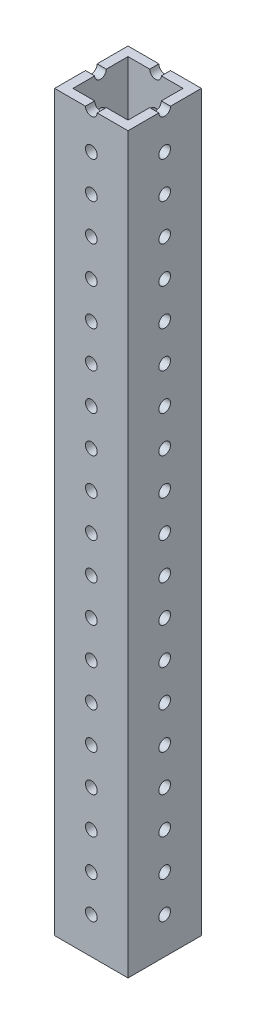
from build123d import *

# Parameters (mm, degrees)
SKETCH1_W           = 25.4
SKETCH1_H           = 25.4
SKETCH1_W_2         = 19.05
SKETCH1_H_2         = 19.05
BOSS_EXTRUDE1_DEPTH = 254
SKETCH2_R           = 2.0193
CUT_EXTRUDE1_DEPTH  = 635
SKETCH3_R           = 2.0193
CUT_EXTRUDE2_DEPTH  = 635


with BuildPart() as part:
    # Sketch1 → Boss-Extrude1 (new body)
    with BuildSketch(Plane(origin=(0, 0, 0), x_dir=(1, 0, 0), z_dir=(0, 1, 0))):
        with Locations((12.7, 12.7)):
            Rectangle(SKETCH1_W, SKETCH1_H)
        with Locations((12.7, 12.7)):
            Rectangle(SKETCH1_W_2, SKETCH1_H_2, mode=Mode.SUBTRACT)
    extrude(amount=BOSS_EXTRUDE1_DEPTH)

    # Sketch2 → Cut-Extrude1 (cut)
    with BuildSketch(Plane.XY):
        with Locations((12.7, 12.7)):
            Circle(SKETCH2_R)
        with Locations((12.7, 25.4)):
            Circle(SKETCH2_R)
        with Locations((12.7, 38.1)):
            Circle(SKETCH2_R)
        with Locations((12.7, 50.8)):
            Circle(SKETCH2_R)
        with Locations((12.7, 63.5)):
            Circle(SKETCH2_R)
        with Locations((12.7, 76.2)):
            Circle(SKETCH2_R)
        with Locations((12.7, 88.9)):
            Circle(SKETCH2_R)
        with Locations((12.7, 101.6)):
            Circle(SKETCH2_R)
        with Locations((12.7, 114.3)):
            Circle(SKETCH2_R)
        with Locations((12.7, 127)):
            Circle(SKETCH2_R)
        with Locations((12.7, 139.7)):
            Circle(SKETCH2_R)
        with Locations((12.7, 152.4)):
            Circle(SKETCH2_R)
        with Locations((12.7, 165.1)):
            Circle(SKETCH2_R)
        with Locations((12.7, 177.8)):
            Circle(SKETCH2_R)
        with Locations((12.7, 190.5)):
            Circle(SKETCH2_R)
        with Locations((12.7, 203.2)):
            Circle(SKETCH2_R)
        with Locations((12.7, 215.9)):
            Circle(SKETCH2_R)
        with Locations((12.7, 228.6)):
            Circle(SKETCH2_R)
        with Locations((12.7, 241.3)):
            Circle(SKETCH2_R)
        with Locations((12.7, 254)):
            Circle(SKETCH2_R)
        with Locations((12.7, 266.7)):
            Circle(SKETCH2_R)
        with Locations((12.7, 279.4)):
            Circle(SKETCH2_R)
        with Locations((12.7, 292.1)):
            Circle(SKETCH2_R)
        with Locations((12.7, 304.8)):
            Circle(SKETCH2_R)
        with Locations((12.7, 317.5)):
            Circle(SKETCH2_R)
        with Locations((12.7, 330.2)):
            Circle(SKETCH2_R)
        with Locations((12.7, 342.9)):
            Circle(SKETCH2_R)
        with Locations((12.7, 355.6)):
            Circle(SKETCH2_R)
        with Locations((12.7, 368.3)):
            Circle(SKETCH2_R)
        with Locations((12.7, 381)):
            Circle(SKETCH2_R)
        with Locations((12.7, 393.7)):
            Circle(SKETCH2_R)
        with Locations((12.7, 406.4)):
            Circle(SKETCH2_R)
        with Locations((12.7, 419.1)):
            Circle(SKETCH2_R)
        with Locations((12.7, 431.8)):
            Circle(SKETCH2_R)
        with Locations((12.7, 444.5)):
            Circle(SKETCH2_R)
        with Locations((12.7, 457.2)):
            Circle(SKETCH2_R)
        with Locations((12.7, 469.9)):
            Circle(SKETCH2_R)
        with Locations((12.7, 482.6)):
            Circle(SKETCH2_R)
        with Locations((12.7, 495.3)):
            Circle(SKETCH2_R)
        with Locations((12.7, 508)):
            Circle(SKETCH2_R)
        with Locations((12.7, 520.7)):
            Circle(SKETCH2_R)
        with Locations((12.7, 533.4)):
            Circle(SKETCH2_R)
        with Locations((12.7, 546.1)):
            Circle(SKETCH2_R)
        with Locations((12.7, 558.8)):
            Circle(SKETCH2_R)
        with Locations((12.7, 571.5)):
            Circle(SKETCH2_R)
        with Locations((12.7, 584.2)):
            Circle(SKETCH2_R)
        with Locations((12.7, 596.9)):
            Circle(SKETCH2_R)
        with Locations((12.7, 609.6)):
            Circle(SKETCH2_R)
        with Locations((12.7, 622.3)):
            Circle(SKETCH2_R)
    extrude(amount=-CUT_EXTRUDE1_DEPTH, mode=Mode.SUBTRACT)

    # Sketch3 → Cut-Extrude2 (cut)
    with BuildSketch(Plane(origin=(25.4, 0, 0), x_dir=(0, 0, -1), z_dir=(1, 0, 0))):
        with Locations((12.7, 12.7)):
            Circle(SKETCH3_R)
        with Locations((12.7, 25.4)):
            Circle(SKETCH3_R)
        with Locations((12.7, 38.1)):
            Circle(SKETCH3_R)
        with Locations((12.7, 50.8)):
            Circle(SKETCH3_R)
        with Locations((12.7, 63.5)):
            Circle(SKETCH3_R)
        with Locations((12.7, 76.2)):
            Circle(SKETCH3_R)
        with Locations((12.7, 88.9)):
            Circle(SKETCH3_R)
        with Locations((12.7, 101.6)):
            Circle(SKETCH3_R)
        with Locations((12.7, 114.3)):
            Circle(SKETCH3_R)
        with Locations((12.7, 127)):
            Circle(SKETCH3_R)
        with Locations((12.7, 139.7)):
            Circle(SKETCH3_R)
        with Locations((12.7, 152.4)):
            Circle(SKETCH3_R)
        with Locations((12.7, 165.1)):
            Circle(SKETCH3_R)
        with Locations((12.7, 177.8)):
            Circle(SKETCH3_R)
        with Locations((12.7, 190.5)):
            Circle(SKETCH3_R)
        with Locations((12.7, 203.2)):
            Circle(SKETCH3_R)
        with Locations((12.7, 215.9)):
            Circle(SKETCH3_R)
        with Locations((12.7, 228.6)):
            Circle(SKETCH3_R)
        with Locations((12.7, 241.3)):
            Circle(SKETCH3_R)
        with Locations((12.7, 254)):
            Circle(SKETCH3_R)
        with Locations((12.7, 266.7)):
            Circle(SKETCH3_R)
        with Locations((12.7, 279.4)):
            Circle(SKETCH3_R)
        with Locations((12.7, 292.1)):
            Circle(SKETCH3_R)
        with Locations((12.7, 304.8)):
            Circle(SKETCH3_R)
        with Locations((12.7, 317.5)):
            Circle(SKETCH3_R)
        with Locations((12.7, 330.2)):
            Circle(SKETCH3_R)
        with Locations((12.7, 342.9)):
            Circle(SKETCH3_R)
        with Locations((12.7, 355.6)):
            Circle(SKETCH3_R)
        with Locations((12.7, 368.3)):
            Circle(SKETCH3_R)
        with Locations((12.7, 381)):
            Circle(SKETCH3_R)
        with Locations((12.7, 393.7)):
            Circle(SKETCH3_R)
        with Locations((12.7, 406.4)):
            Circle(SKETCH3_R)
        with Locations((12.7, 419.1)):
            Circle(SKETCH3_R)
        with Locations((12.7, 431.8)):
            Circle(SKETCH3_R)
        with Locations((12.7, 444.5)):
            Circle(SKETCH3_R)
        with Locations((12.7, 457.2)):
            Circle(SKETCH3_R)
        with Locations((12.7, 469.9)):
            Circle(SKETCH3_R)
        with Locations((12.7, 482.6)):
            Circle(SKETCH3_R)
        with Locations((12.7, 495.3)):
            Circle(SKETCH3_R)
        with Locations((12.7, 508)):
            Circle(SKETCH3_R)
        with Locations((12.7, 520.7)):
            Circle(SKETCH3_R)
        with Locations((12.7, 533.4)):
            Circle(SKETCH3_R)
        with Locations((12.7, 546.1)):
            Circle(SKETCH3_R)
        with Locations((12.7, 558.8)):
            Circle(SKETCH3_R)
        with Locations((12.7, 571.5)):
            Circle(SKETCH3_R)
        with Locations((12.7, 584.2)):
            Circle(SKETCH3_R)
        with Locations((12.7, 596.9)):
            Circle(SKETCH3_R)
        with Locations((12.7, 609.6)):
            Circle(SKETCH3_R)
        with Locations((12.7, 622.3)):
            Circle(SKETCH3_R)
    extrude(amount=-CUT_EXTRUDE2_DEPTH, mode=Mode.SUBTRACT)


solid = part.part
